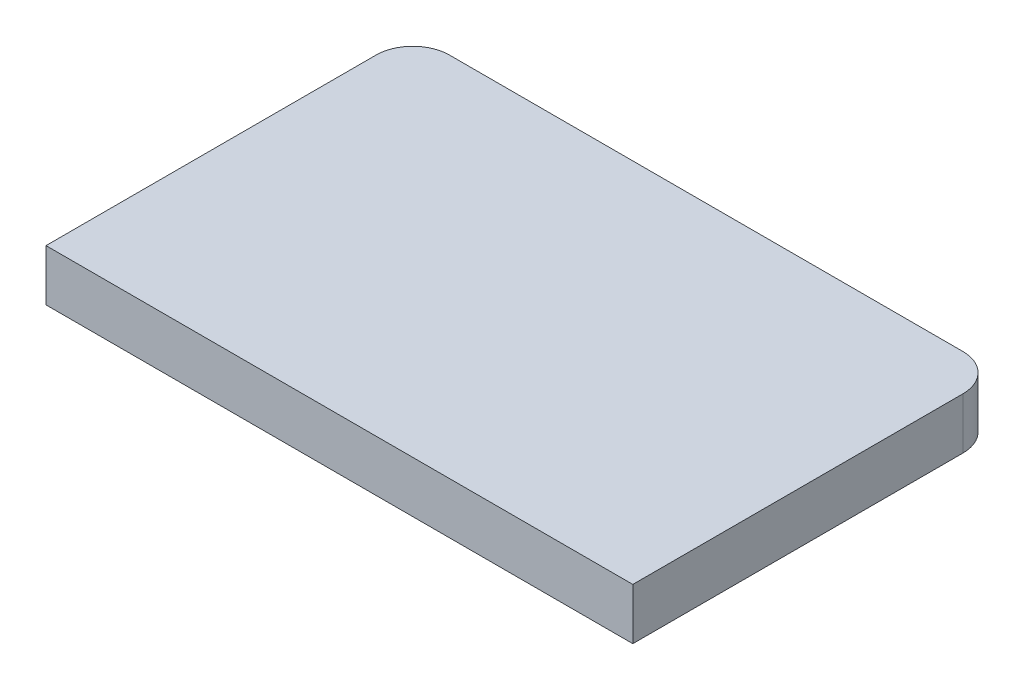
from build123d import *

# Parameters (mm, degrees)
SKETCH2_W           = 203.2
SKETCH2_H           = 127
BOSS_EXTRUDE2_DEPTH = 17.78
FILLET1_R           = 12.7
SKETCH5_R           = 2.0828
CUT_EXTRUDE2_DEPTH  = 12.7


with BuildPart() as part:
    # Sketch2 → Boss-Extrude2 (new body)
    with BuildSketch(Plane(origin=(0, 0, 0), x_dir=(1, 0, 0), z_dir=(0, 1, 0))):
        Rectangle(SKETCH2_W, SKETCH2_H)
    extrude(amount=BOSS_EXTRUDE2_DEPTH)

    # Fillet1
    fillet1_edges = [part.edges().sort_by_distance(p)[0] for p in [
        (-101.6, 8.89, -63.5),
        (101.6, 8.89, -63.5),
    ]]
    fillet(fillet1_edges, radius=FILLET1_R)

    # Sketch5 → Cut-Extrude2 (cut)
    with BuildSketch(Plane.XZ):
        with Locations(Location((50.8, 49.8348, 0), (0, 0, 270))):
            Circle(SKETCH5_R)
        with Locations(Location((33.5788, 25.0698, 0), (0, 0, 270))):
            Circle(SKETCH5_R)
        with Locations(Location((-50.8, 25.0698, 0), (0, 0, 270))):
            Circle(SKETCH5_R)
        with Locations(Location((-33.5788, 49.8348, 0), (0, 0, 270))):
            Circle(SKETCH5_R)
    extrude(amount=-CUT_EXTRUDE2_DEPTH, mode=Mode.SUBTRACT)


solid = part.part
